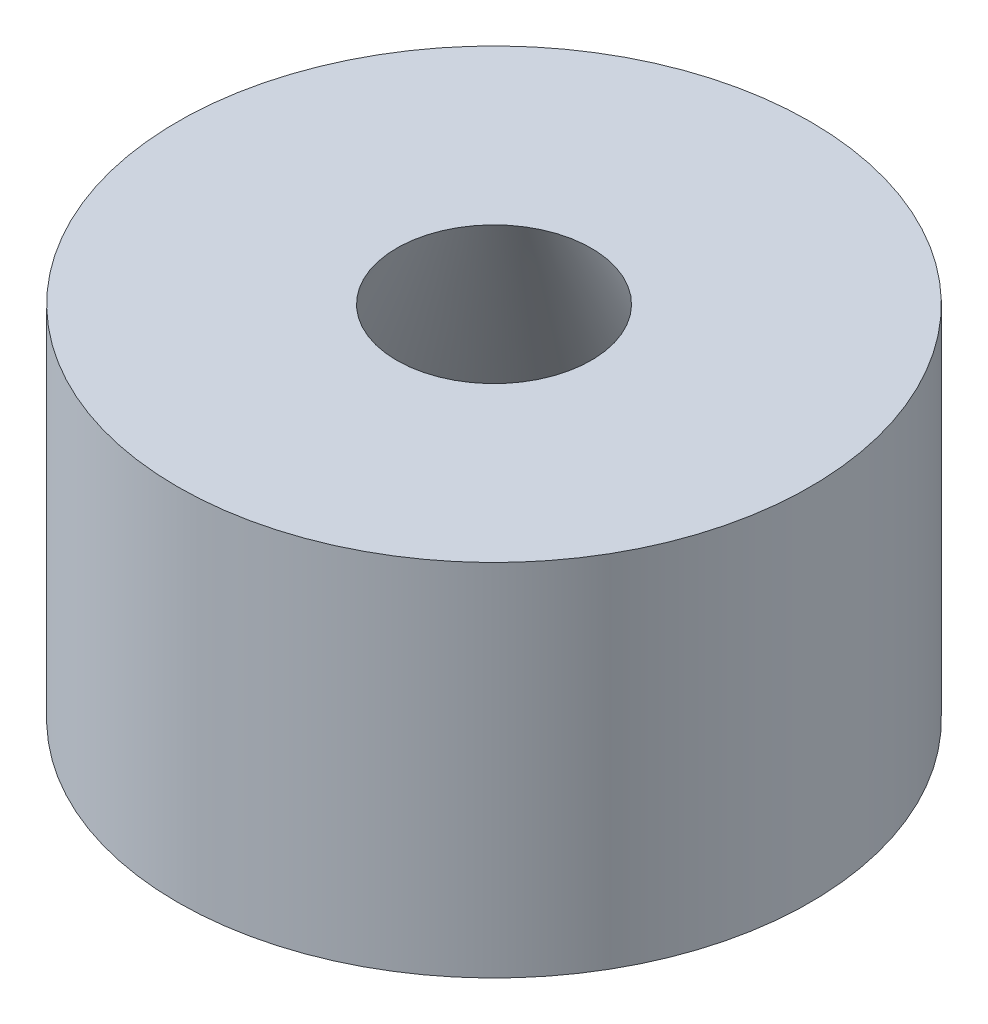
from build123d import *

# Parameters (mm, degrees)
SKETCH1_R           = 8.79
SKETCH1_R_2         = 7.579999953
BOSS_EXTRUDE1_DEPTH = 10
DRAFT3_ANGLE        = 26


with BuildPart() as part:
    # Sketch1 → Boss-Extrude1 (new body)
    with BuildSketch(Plane(origin=(0, 0, 0), x_dir=(1, 0, 0), z_dir=(0, 1, 0))):
        with Locations(Location((0, 0, 0), (0, 0, 270))):
            Circle(SKETCH1_R)
        with Locations(Location((0, 0, 0), (0, 0, 270))):
            Circle(SKETCH1_R_2, mode=Mode.SUBTRACT)
    extrude(amount=BOSS_EXTRUDE1_DEPTH)

    # Draft3
    draft3_faces = [part.faces().sort_by_distance(p)[0] for p in [
        (0, 5, -7.579999953),
    ]]
    draft(draft3_faces, Plane(origin=(0, 0, 0), x_dir=(0, 0, -1), z_dir=(0, -1, 0)), DRAFT3_ANGLE)


solid = part.part
